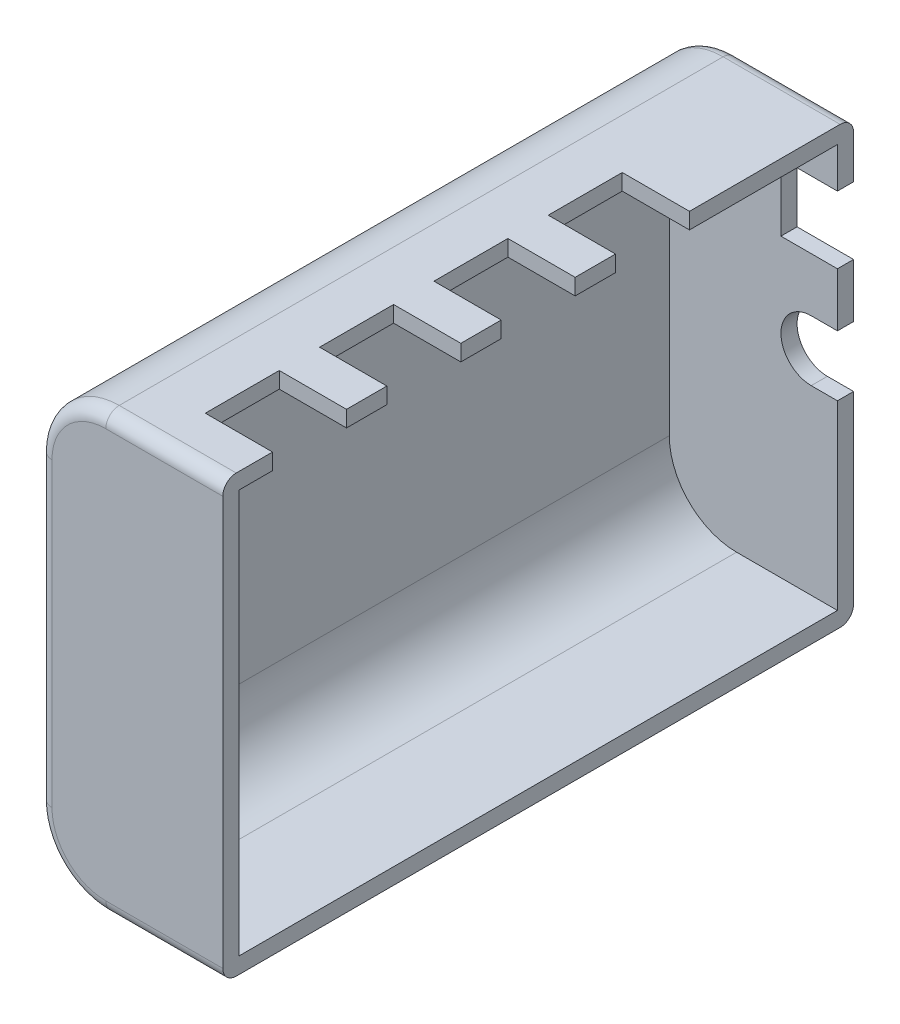
from build123d import *

# Parameters (mm, degrees)
SKETCH1_W           = 44.5
SKETCH1_H           = 30
BOSS_EXTRUDE1_DEPTH = 12.5
SHELL1_T            = 1.2
SKETCH2_W           = 5
SKETCH2_H           = 5.5
CUT_EXTRUDE1_DEPTH  = 1.2
SKETCH3_W           = 4.2
SKETCH3_H           = 5
CUT_EXTRUDE2_DEPTH  = 1.2
FILLET1_R           = 5
FILLET2_R           = 1


with BuildPart() as part:
    # Sketch1 → Boss-Extrude1 (new body)
    with BuildSketch(Plane.ZY.offset(-16.037488601)):
        with Locations((35.888343158, 24.809192207)):
            Rectangle(SKETCH1_W, SKETCH1_H)
    extrude(amount=BOSS_EXTRUDE1_DEPTH)

    # Shell1
    shell1_openings = [part.faces().sort_by_distance(p)[0] for p in [
        (16.037488601, 24.809192207, 35.888343158),
    ]]
    offset(amount=SHELL1_T, openings=shell1_openings, kind=Kind.INTERSECTION)

    # Sketch2 → Cut-Extrude1 (cut)
    with BuildSketch(Plane(origin=(0, 41.009192207, 0), x_dir=(1, 0, 0), z_dir=(0, 1, 0))):
        with Locations((13.537488601, -52.888343158)):
            Rectangle(SKETCH2_W, SKETCH2_H)
        with Locations((13.537488601, -44.388343158)):
            Rectangle(SKETCH2_W, SKETCH2_H)
        with Locations((13.537488601, -35.888343158)):
            Rectangle(SKETCH2_W, SKETCH2_H)
        with Locations((13.537488601, -27.388343158)):
            Rectangle(SKETCH2_W, SKETCH2_H)
    extrude(amount=-CUT_EXTRUDE1_DEPTH, mode=Mode.SUBTRACT)

    # Sketch3 → Cut-Extrude2 (cut)
    with BuildSketch(Plane(origin=(0, 0, 12.438343158), x_dir=(-1, 0, 0), z_dir=(0, 0, -1))):
        with Locations((-13.937488601, 34.309192207)):
            Rectangle(SKETCH3_W, SKETCH3_H)
        with BuildLine():
            Line((-16.037488601, 27.809192207), (-14.087488601, 27.809192207))
            ThreePointArc((-14.087488601, 27.809192207), (-11.837488601, 25.559192207), (-14.087488601, 23.309192207))
            Line((-14.087488601, 23.309192207), (-16.037488601, 23.309192207))
            Line((-16.037488601, 23.309192207), (-16.037488601, 27.809192207))
        make_face()
    extrude(amount=-CUT_EXTRUDE2_DEPTH, mode=Mode.SUBTRACT)

    # Fillet1
    fillet1_edges = [part.edges().sort_by_distance(p)[0] for p in [
        (2.337488601, 41.009192207, 35.888343158),
        (3.537488601, 9.809192207, 35.888343158),
        (3.537488601, 39.809192207, 35.888343158),
        (2.337488601, 8.609192207, 35.888343158),
    ]]
    fillet(fillet1_edges, radius=FILLET1_R)

    # Fillet2
    fillet2_edges = [part.edges().sort_by_distance(p)[0] for p in [
        (2.337488601, 24.809192207, 12.438343158),
        (2.337488601, 24.809192207, 59.338343158),
        (11.687488601, 41.009192207, 59.338343158),
        (11.687488601, 8.609192207, 59.338343158),
        (3.801954695, 39.544726113, 59.338343158),
        (3.801954695, 10.073658301, 59.338343158),
        (11.687488601, 8.609192207, 12.438343158),
        (11.687488601, 41.009192207, 12.438343158),
        (3.801954695, 39.544726113, 12.438343158),
        (3.801954695, 10.073658301, 12.438343158),
    ]]
    fillet(fillet2_edges, radius=FILLET2_R)


solid = part.part
